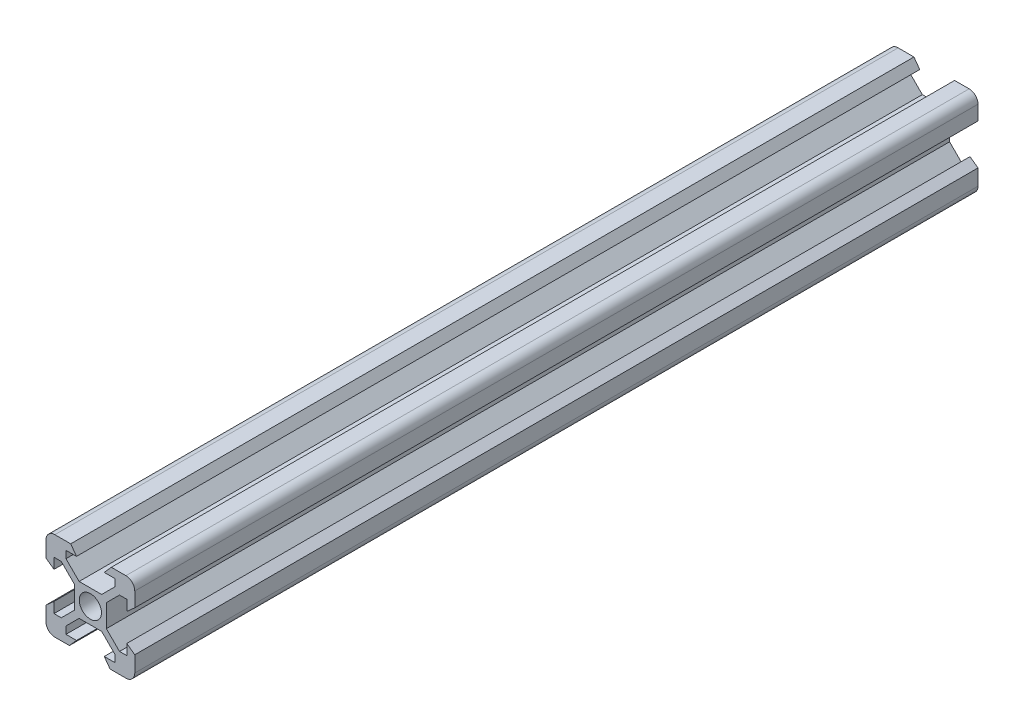
from build123d import *

# Parameters (mm, degrees)
SKETCH1_R           = 2.5
BOSS_EXTRUDE1_DEPTH = 190


with BuildPart() as part:
    # Sketch1 → Boss-Extrude1 (new body)
    with BuildSketch(Plane.XY):
        with BuildLine():
            Line((-4.725542729, -10), (-3.125, -8.2))
            Line((-3.125, -8.2), (-5.5, -8.2))
            Line((-5.5, -8.2), (-5.5, -6.560660172))
            Line((-5.5, -6.560660172), (-2.539339828, -3.6))
            Line((-2.539339828, -3.6), (2.539339828, -3.6))
            Line((2.539339828, -3.6), (5.5, -6.560660172))
            Line((5.5, -6.560660172), (5.5, -8.2))
            Line((5.5, -8.2), (3.125, -8.2))
            Line((3.125, -8.2), (4.434457271, -10))
            Line((4.434457271, -10), (8, -10))
            ThreePointArc((8, -10), (9.414213562, -9.414213562), (10, -8))
            Line((10, -8), (10, -4.434457271))
            Line((10, -4.434457271), (8.2, -3.125))
            Line((8.2, -3.125), (8.2, -5.5))
            Line((8.2, -5.5), (6.560660172, -5.5))
            Line((6.560660172, -5.5), (3.6, -2.539339828))
            Line((3.6, -2.539339828), (3.6, 2.539339828))
            Line((3.6, 2.539339828), (6.560660172, 5.5))
            Line((6.560660172, 5.5), (8.2, 5.5))
            Line((8.2, 5.5), (8.2, 3.125))
            Line((8.2, 3.125), (10, 4.725542729))
            Line((10, 4.725542729), (10, 8))
            ThreePointArc((10, 8), (9.414213562, 9.414213562), (8, 10))
            Line((8, 10), (4.725542729, 10))
            Line((4.725542729, 10), (3.125, 8.2))
            Line((3.125, 8.2), (5.5, 8.2))
            Line((5.5, 8.2), (5.5, 6.560660172))
            Line((5.5, 6.560660172), (2.539339828, 3.6))
            Line((2.539339828, 3.6), (-2.539339828, 3.6))
            Line((-2.539339828, 3.6), (-5.5, 6.560660172))
            Line((-5.5, 6.560660172), (-5.5, 8.2))
            Line((-5.5, 8.2), (-3.125, 8.2))
            Line((-3.125, 8.2), (-4.434457271, 10))
            Line((-4.434457271, 10), (-8, 10))
            ThreePointArc((-8, 10), (-9.414213562, 9.414213562), (-10, 8))
            Line((-10, 8), (-10, 4.434457271))
            Line((-10, 4.434457271), (-8.2, 3.125))
            Line((-8.2, 3.125), (-8.2, 5.5))
            Line((-8.2, 5.5), (-6.560660172, 5.5))
            Line((-6.560660172, 5.5), (-3.6, 2.539339828))
            Line((-3.6, 2.539339828), (-3.6, -2.539339828))
            Line((-3.6, -2.539339828), (-6.560660172, -5.5))
            Line((-6.560660172, -5.5), (-8.2, -5.5))
            Line((-8.2, -5.5), (-8.2, -3.125))
            Line((-8.2, -3.125), (-10, -4.725542729))
            Line((-10, -4.725542729), (-10, -8))
            ThreePointArc((-10, -8), (-9.414213562, -9.414213562), (-8, -10))
            Line((-8, -10), (-4.725542729, -10))
        make_face()
        Circle(SKETCH1_R, mode=Mode.SUBTRACT)
    extrude(amount=BOSS_EXTRUDE1_DEPTH)


solid = part.part
